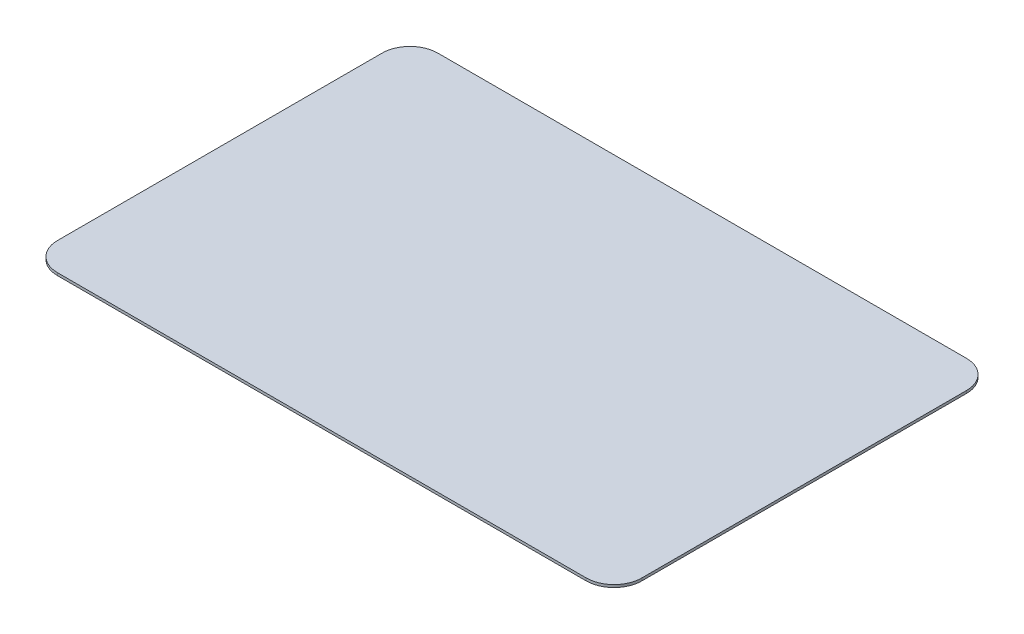
from build123d import *

# Parameters (mm, degrees)
EXTRUDE_1_DEPTH = 0.28


with BuildPart() as part:
    # Эскиз1 → Бобышка-Вытянуть1 (new body)
    with BuildSketch(Plane(origin=(0, 0, 0), x_dir=(1, 0, 0), z_dir=(0, 1, 0))):
        with BuildLine():
            Line((3, 0), (60, 0))
            ThreePointArc((60, 0), (62.121320344, -0.878679656), (63, -3))
            Line((63, -3), (63, -38))
            ThreePointArc((63, -38), (62.121320344, -40.121320344), (60, -41))
            Line((60, -41), (3, -41))
            ThreePointArc((3, -41), (0.878679656, -40.121320344), (0, -38))
            Line((0, -38), (0, -3))
            ThreePointArc((0, -3), (0.878679656, -0.878679656), (3, 0))
        make_face()
    extrude(amount=EXTRUDE_1_DEPTH)


solid = part.part
